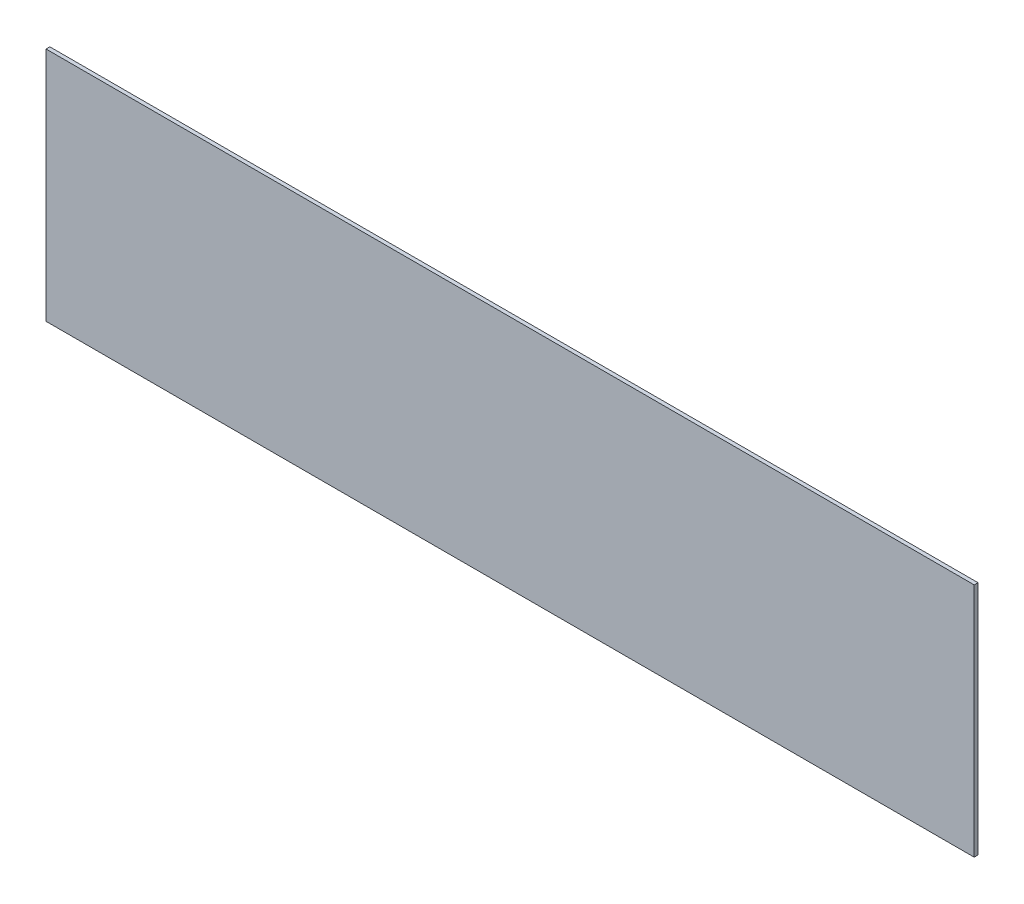
from build123d import *

# Parameters (mm, degrees)
SKETCH_1_W      = 2440
SKETCH_1_H      = 620
EXTRUDE_1_DEPTH = 10


with BuildPart() as part:
    # Эскиз1 → Бобышка-Вытянуть1 (new body)
    with BuildSketch(Plane.XY):
        with Locations((1220, 310)):
            Rectangle(SKETCH_1_W, SKETCH_1_H)
    extrude(amount=EXTRUDE_1_DEPTH)


solid = part.part
